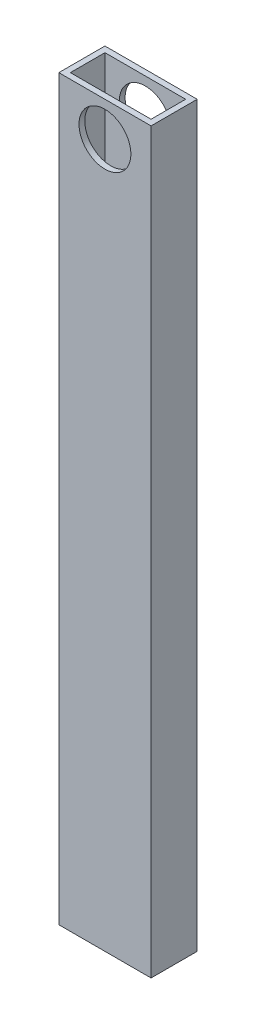
from build123d import *

# Parameters (mm, degrees)
SKETCH1_W           = 50.8
SKETCH1_H           = 25.4
BOSS_EXTRUDE1_DEPTH = 406.4
SHELL1_T            = -3.175
SKETCH2_R           = 14.2875
CUT_EXTRUDE1_DEPTH  = 406.4


with BuildPart() as part:
    # Sketch1 → Boss-Extrude1 (new body)
    with BuildSketch(Plane(origin=(0, 0, 0), x_dir=(1, 0, 0), z_dir=(0, 1, 0))):
        Rectangle(SKETCH1_W, SKETCH1_H)
    extrude(amount=BOSS_EXTRUDE1_DEPTH)

    # Shell1
    shell1_openings = [part.faces().sort_by_distance(p)[0] for p in [
        (0, 406.4, 0),
        (0, 0, 0),
    ]]
    offset(amount=SHELL1_T, openings=shell1_openings, kind=Kind.INTERSECTION)

    # Sketch2 → Cut-Extrude1 (cut)
    with BuildSketch(Plane.XY.offset(12.7)):
        with Locations((0, 387.35)):
            Circle(SKETCH2_R)
    extrude(amount=-CUT_EXTRUDE1_DEPTH, mode=Mode.SUBTRACT)


solid = part.part
